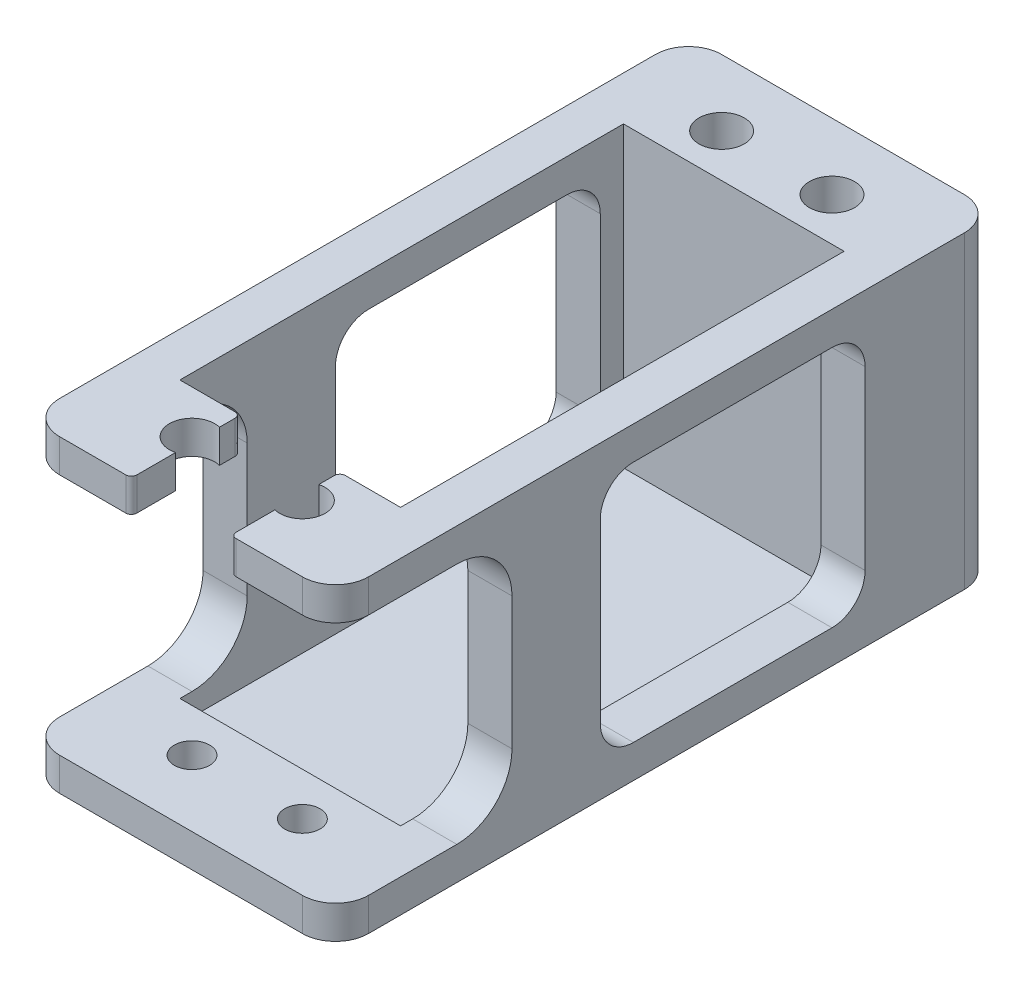
from build123d import *

# Parameters (mm, degrees)
SKETCH_1_W                      = 28
SKETCH_1_H                      = 60
SKETCH_1_R                      = 2.05
SKETCH_1_W_2                    = 20
SKETCH_1_H_2                    = 40.2
EXTRUDE_1_DEPTH                 = 28
CUT_EXTRUDE_3_DEPTH             = 51.714987923
CUT_EXTRUDE_3_DEPTH_BACK        = 51.714987923
SKETCH_4_W                      = 16
SKETCH_4_H                      = 22
FILLET_3_R                      = 5
FILLET_1_R                      = 3
SKETCH_6_R                      = 2.05
SKETCH_6_R_2                    = 1.6
EXTRUDE_3_DEPTH                 = 3
CUT_EXTRUDE_4_REACH             = 52.715
SKETCH_7_W                      = 9
SKETCH_7_H                      = 9.9
CUT_EXTRUDE_4_DIRECTION_2_DEPTH = 51.714987923
SKETCH_9_W                      = 20
SKETCH_9_H                      = 40.2
EXTRUDE_4_DEPTH                 = 1
FILLET_4_R                      = 0.5


with BuildPart() as part:
    # 草图1 → 凸台-拉伸1 (new body)
    with BuildSketch(Plane(origin=(0, 0, 0), x_dir=(1, 0, 0), z_dir=(0, 1, 0))):
        with Locations((0, -9.9)):
            Rectangle(SKETCH_1_W, SKETCH_1_H)
        with Locations(Location((-5, 14.1, 0), (0, 0, 270))):
            Circle(SKETCH_1_R, mode=Mode.SUBTRACT)
        with Locations(Location((5, 14.1, 0), (0, 0, 270))):
            Circle(SKETCH_1_R, mode=Mode.SUBTRACT)
        with Locations(Location((-5, -33.9, 0), (0, 0, 270))):
            Circle(SKETCH_1_R, mode=Mode.SUBTRACT)
        with Locations(Location((5, -33.9, 0), (0, 0, 270))):
            Circle(SKETCH_1_R, mode=Mode.SUBTRACT)
        with Locations((0, -9.9)):
            Rectangle(SKETCH_1_W_2, SKETCH_1_H_2, mode=Mode.SUBTRACT)
    extrude(amount=EXTRUDE_1_DEPTH)

    # 草图4 → 切除-拉伸3 (cut, two sides: drawn at the far end of the back side and taken through both)
    with BuildSketch(Plane(origin=(0, 0, 0), x_dir=(0, 0, -1), z_dir=(1, 0, 0)).offset(-CUT_EXTRUDE_3_DEPTH_BACK)):
        with Locations((-31.9, 14)):
            Rectangle(SKETCH_4_W, SKETCH_4_H)
        with BuildLine():
            Line((-12.9, 25), (5.1, 25))
            ThreePointArc((5.1, 25), (7.221320344, 24.121320344), (8.1, 22))
            Line((8.1, 22), (8.1, 6))
            ThreePointArc((8.1, 6), (7.221320344, 3.878679656), (5.1, 3))
            Line((5.1, 3), (-12.9, 3))
            ThreePointArc((-12.9, 3), (-15.021320344, 3.878679656), (-15.9, 6))
            Line((-15.9, 6), (-15.9, 22))
            ThreePointArc((-15.9, 22), (-15.021320344, 24.121320344), (-12.9, 25))
        make_face()
    extrude(amount=CUT_EXTRUDE_3_DEPTH + CUT_EXTRUDE_3_DEPTH_BACK, mode=Mode.SUBTRACT)

    # 圆角3
    fillet_3_edges = [part.edges().sort_by_distance(p)[0] for p in [
        (-12, 25, 23.9),
        (12, 25, 23.9),
        (12, 3, 23.9),
        (-12, 3, 23.9),
    ]]
    fillet(fillet_3_edges, radius=FILLET_3_R)

    # 圆角1
    fillet_1_edges = [part.edges().sort_by_distance(p)[0] for p in [
        (14, 1.5, 39.9),
        (-14, 1.5, 39.9),
        (14, 26.5, 39.9),
        (-14, 26.5, 39.9),
        (-14, 14, -20.1),
        (14, 14, -20.1),
    ]]
    fillet(fillet_1_edges, radius=FILLET_1_R)

    # 草图6 → 凸台-拉伸3 (add)
    # profile 1 of 2: a face of its own
    with BuildSketch(Plane.XZ):
        with Locations(Location((-5, 33.9, 0), (0, 0, 90))):
            Circle(SKETCH_6_R)
        with Locations(Location((-5, 33.9, 0), (0, 0, 270))):
            Circle(SKETCH_6_R_2, mode=Mode.SUBTRACT)
    # profile 2 of 2: a face of its own
    with BuildSketch(Plane.XZ):
        with Locations(Location((5, 33.9, 0), (0, 0, 90))):
            Circle(SKETCH_6_R)
        with Locations(Location((5, 33.9, 0), (0, 0, 270))):
            Circle(SKETCH_6_R_2, mode=Mode.SUBTRACT)
    extrude(amount=-EXTRUDE_3_DEPTH)

    # 草图7 → 切除-拉伸4 (cut, up to next)
    with BuildSketch(Plane(origin=(0, 28, 0), x_dir=(1, 0, 0), z_dir=(0, 1, 0)), mode=Mode.PRIVATE) as cut_extrude_4_sk1:
        with Locations((0, -34.95)):
            Rectangle(SKETCH_7_W, SKETCH_7_H)
    cut_extrude_4_tool1 = extrude(cut_extrude_4_sk1.sketch, amount=-CUT_EXTRUDE_4_REACH, mode=Mode.PRIVATE) & part.part
    add(cut_extrude_4_tool1.solids().sort_by_distance((0, 28, 34.95))[0], mode=Mode.SUBTRACT)

    # 草图7 → 切除-拉伸4 direction 2 (cut)
    with BuildSketch(Plane(origin=(0, 28, 0), x_dir=(1, 0, 0), z_dir=(0, 1, 0))):
        with Locations((0, -34.95)):
            Rectangle(SKETCH_7_W, SKETCH_7_H)
    extrude(amount=CUT_EXTRUDE_4_DIRECTION_2_DEPTH, mode=Mode.SUBTRACT)

    # 草图9 → 凸台-拉伸4 (add)
    with BuildSketch(Plane.XZ):
        with Locations((0, 9.9)):
            Rectangle(SKETCH_9_W, SKETCH_9_H)
    extrude(amount=-EXTRUDE_4_DEPTH)

    # 圆角4
    fillet_4_edges = [part.edges().sort_by_distance(p)[0] for p in [
        (-4.5, 26.5, 30),
        (-4.5, 26.5, 39.9),
        (4.5, 26.5, 39.9),
        (4.5, 26.5, 30),
    ]]
    fillet(fillet_4_edges, radius=FILLET_4_R)


solid = part.part
